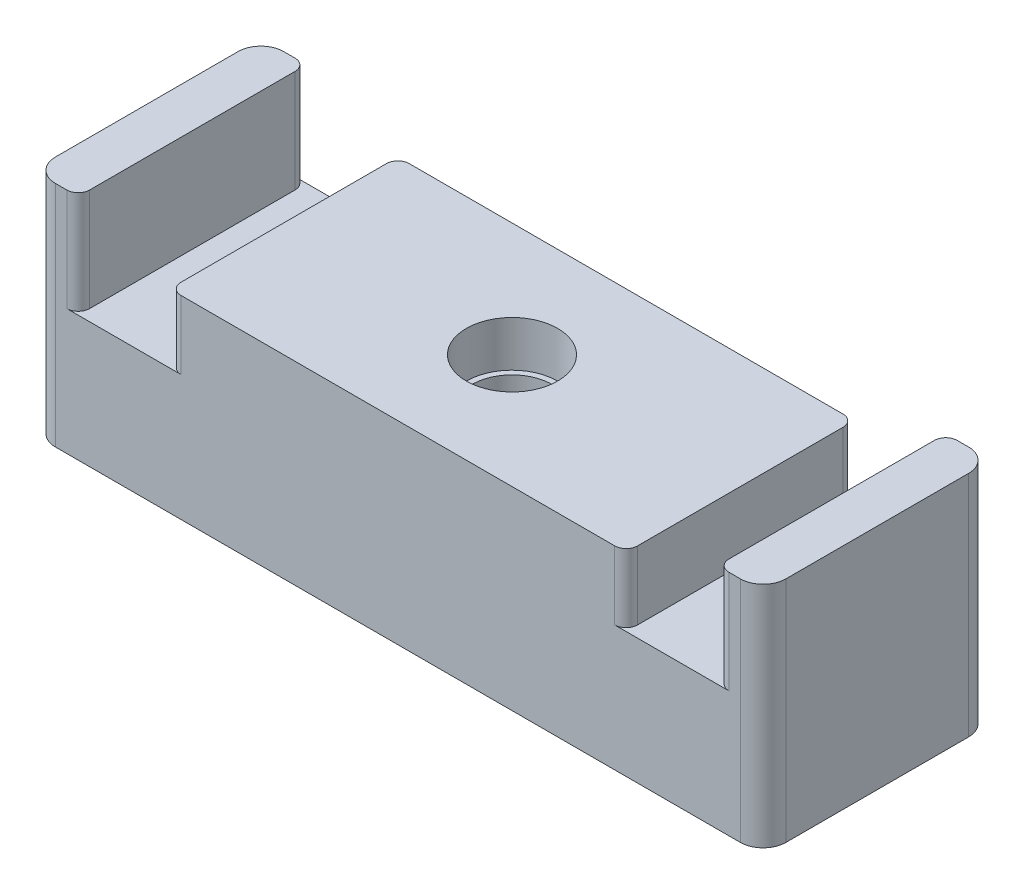
from build123d import *

# Parameters (mm, degrees)
BOSS_EXTRUDE1_DEPTH = 10
SKETCH2_R           = 1.75
CUT_EXTRUDE1_DEPTH  = 22.354156504
FILLET2_R           = 1
FILLET3_R           = 0.5
SKETCH4_W           = 20
SKETCH4_H           = 10
CUT_EXTRUDE3_DEPTH  = 1.5
SKETCH5_R           = 2
CUT_EXTRUDE4_DEPTH  = 2


with BuildPart() as part:
    # Sketch1 → Boss-Extrude1 (new body)
    with BuildSketch(Plane.XY):
        Polygon((-10, 2.5), (10, 2.5), (10, 0), (10, -2), (14, -2), (14, 0), (14, 2.5), (16, 2.5), (16, -7.5), (-16, -7.5), (-16, 2.5), (-14, 2.5), (-14, 0), (-14, -2), (-10, -2), (-10, 0), align=None)
    extrude(amount=BOSS_EXTRUDE1_DEPTH)

    # Sketch2 → Cut-Extrude1 (cut, through all)
    with BuildSketch(Plane(origin=(0, 2.5, 0), x_dir=(1, 0, 0), z_dir=(0, 1, 0))):
        with Locations(Location((0, -5, 0), (0, 0, 270))):
            Circle(SKETCH2_R)
    extrude(amount=-CUT_EXTRUDE1_DEPTH, mode=Mode.SUBTRACT)

    # Fillet2
    fillet2_edges = [part.edges().sort_by_distance(p)[0] for p in [
        (16, -2.5, 0),
        (-16, -2.5, 0),
        (-16, -2.5, 10),
        (16, -2.5, 10),
    ]]
    fillet(fillet2_edges, radius=FILLET2_R)

    # Fillet3
    fillet3_edges = [part.edges().sort_by_distance(p)[0] for p in [
        (-10, 0.25, 10),
        (14, 0.25, 0),
        (-14, 0.25, 0),
        (-10, 0.25, 0),
        (10, 0.25, 0),
        (-14, 0.25, 10),
        (10, 0.25, 10),
        (14, 0.25, 10),
    ]]
    fillet(fillet3_edges, radius=FILLET3_R)

    # Sketch4 → Cut-Extrude3 (cut)
    with BuildSketch(Plane(origin=(0, 2.5, 0), x_dir=(1, 0, 0), z_dir=(0, 1, 0))):
        with Locations((0, -5)):
            Rectangle(SKETCH4_W, SKETCH4_H)
    extrude(amount=-CUT_EXTRUDE3_DEPTH, mode=Mode.SUBTRACT)

    # Sketch5 → Cut-Extrude4 (cut)
    with BuildSketch(Plane(origin=(0, 1, 0), x_dir=(1, 0, 0), z_dir=(0, 1, 0))):
        with Locations(Location((0, -5, 0), (0, 0, 270))):
            Circle(SKETCH5_R)
    extrude(amount=-CUT_EXTRUDE4_DEPTH, mode=Mode.SUBTRACT)


solid = part.part
